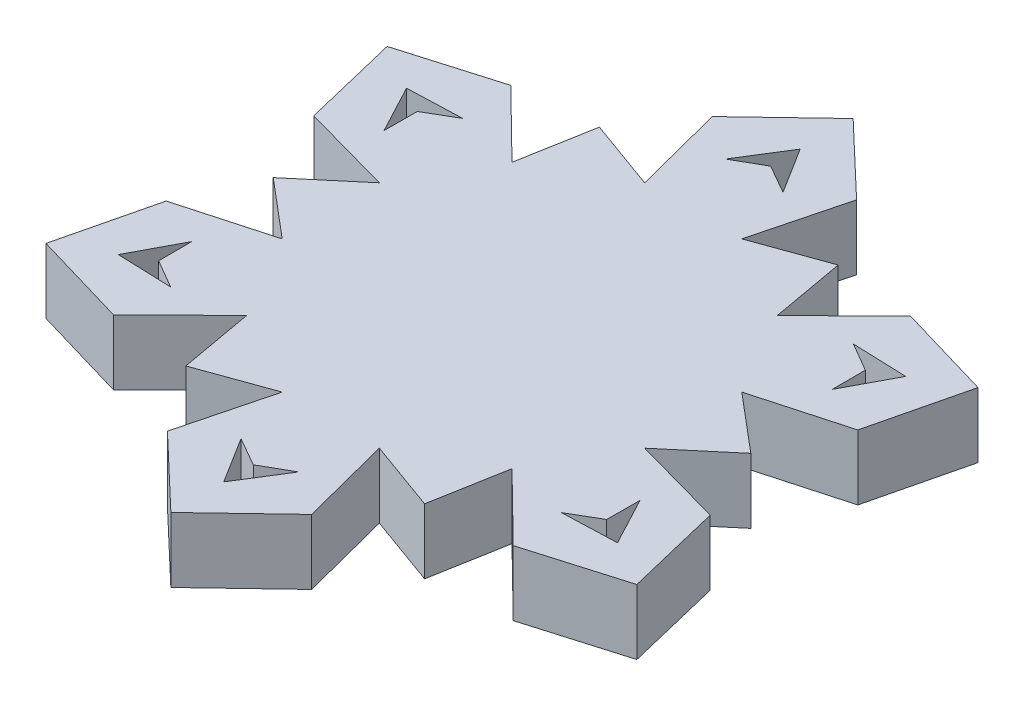
from build123d import *

# Parameters (mm, degrees)
BOSS_EXTRUDE1_DEPTH = 9.525


with BuildPart() as part:
    # Sketch1 → Boss-Extrude1 (new body)
    with BuildSketch(Plane(origin=(0, 0, 0), x_dir=(1, 0, 0), z_dir=(0, 1, 0))):
        Polygon((7.11752374, 26.562960223), (17.5, 30.310889132), (19.445436483, 19.445436483), (29.300117001, 29.120397254), (43.301270189, 25), (39.869062291, 10.81444703), (26.562960223, 7.11752374), (35, 0), (26.562960223, -7.11752374), (39.869062291, -10.81444703), (43.301270189, -25), (29.300117001, -29.120397254), (19.445436483, -19.445436483), (17.5, -30.310889132), (7.11752374, -26.562960223), (10.56894529, -39.934844284), (0, -50), (-10.56894529, -39.934844284), (-7.11752374, -26.562960223), (-17.5, -30.310889132), (-19.445436483, -19.445436483), (-29.300117001, -29.120397254), (-43.301270189, -25), (-39.869062291, -10.81444703), (-26.562960223, -7.11752374), (-35, 0), (-26.562960223, 7.11752374), (-39.869062291, 10.81444703), (-43.301270189, 25), (-29.300117001, 29.120397254), (-19.445436483, 19.445436483), (-17.5, 30.310889132), (-7.11752374, 26.562960223), (-10.56894529, 39.934844284), (0, 50), (10.56894529, 39.934844284), align=None)
        Polygon((0, 42.241346721), (4.219631638, 35.498784797), (0, 37.911261082), (-4.219631638, 35.498784797), align=None, mode=Mode.SUBTRACT)
        Polygon((28.633033619, 21.403700592), (32.832115186, 18.955630541), (32.852665257, 14.095084205), (36.58207935, 21.120673361), align=None, mode=Mode.SUBTRACT)
        Polygon((36.58207935, -21.120673361), (32.852665257, -14.095084205), (32.832115186, -18.955630541), (28.633033619, -21.403700592), align=None, mode=Mode.SUBTRACT)
        Polygon((0, -42.241346721), (4.219631638, -35.498784797), (0, -37.911261082), (-4.219631638, -35.498784797), align=None, mode=Mode.SUBTRACT)
        Polygon((-36.58207935, -21.120673361), (-28.633033619, -21.403700592), (-32.832115186, -18.955630541), (-32.852665257, -14.095084205), align=None, mode=Mode.SUBTRACT)
        Polygon((-36.58207935, 21.120673361), (-32.852665257, 14.095084205), (-32.832115186, 18.955630541), (-28.633033619, 21.403700592), align=None, mode=Mode.SUBTRACT)
    extrude(amount=BOSS_EXTRUDE1_DEPTH)


solid = part.part
